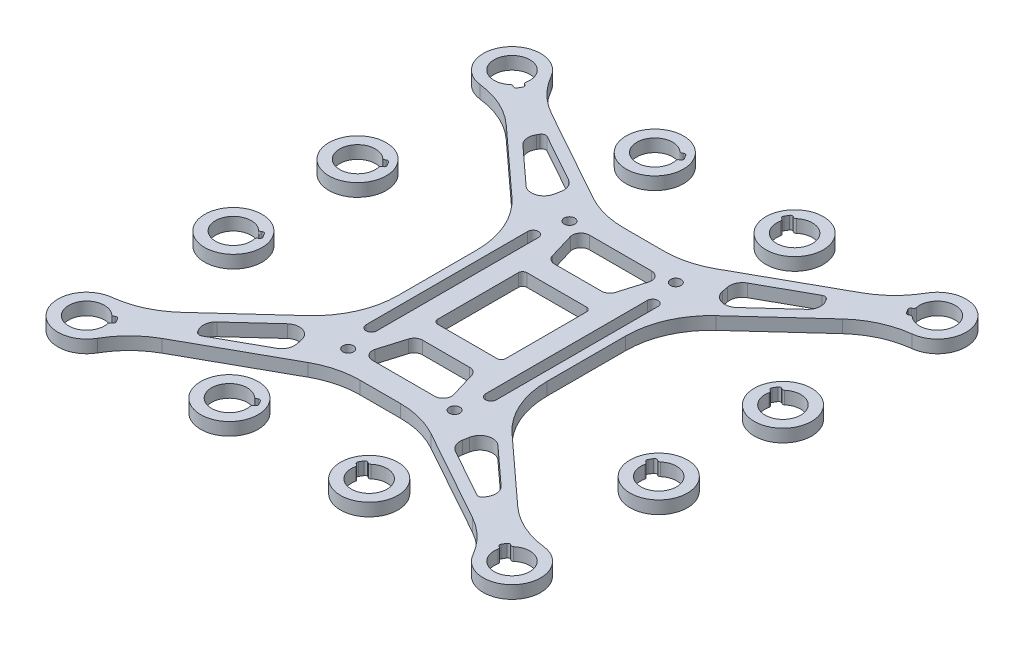
from build123d import *

# Parameters (mm, degrees)
SKETCH1_R             = 6.75
BOSS_EXTRUDE2_DEPTH   = 3
BOSS_EXTRUDE2_2_DEPTH = 3
BOSS_EXTRUDE2_3_DEPTH = 3
BOSS_EXTRUDE2_4_DEPTH = 3
BOSS_EXTRUDE2_5_DEPTH = 3
BOSS_EXTRUDE2_6_DEPTH = 3
BOSS_EXTRUDE2_7_DEPTH = 3
BOSS_EXTRUDE2_8_DEPTH = 3
SKETCH1_R_2           = 1.25
BOSS_EXTRUDE2_9_DEPTH = 3


with BuildPart() as part:
    # Sketch1 → Boss-Extrude2 (new body)
    with BuildSketch(Plane(origin=(0, 0, 0), x_dir=(1, 0, 0), z_dir=(0, 1, 0))):
        with Locations(Location((50, -15.5, 0), (0, 0, 270))):
            Circle(SKETCH1_R)
        with BuildLine():
            Line((46.447201655, -12.264629245), (46.659390087, -12.388677867))
            ThreePointArc((46.659390087, -12.388677867), (46.958645317, -12.454824347), (47.240276851, -12.333941229))
            ThreePointArc((47.240276851, -12.333941229), (53.625846535, -17.619725667), (45.887260468, -14.648311358))
            ThreePointArc((45.887260468, -14.648311358), (45.854440801, -14.34359523), (45.649996913, -14.115271456))
            Line((45.649996913, -14.115271456), (45.43780848, -13.991222834))
            ThreePointArc((45.43780848, -13.991222834), (45.206498076, -13.686358756), (45.258508377, -13.307226143))
            Line((45.258508377, -13.307226143), (45.763204964, -12.443929349))
            ThreePointArc((45.763204964, -12.443929349), (46.068069042, -12.212618944), (46.447201655, -12.264629245))
        make_face(mode=Mode.SUBTRACT)
    extrude(amount=BOSS_EXTRUDE2_DEPTH)


with BuildPart() as body_2:
    # Sketch1 → Boss-Extrude2 2 (new body)
    with BuildSketch(Plane(origin=(0, 0, 0), x_dir=(1, 0, 0), z_dir=(0, 1, 0))):
        with Locations(Location((50, 13.690839766, 0), (0, 0, 270))):
            Circle(SKETCH1_R)
        with BuildLine():
            Line((45.763204964, 16.746910417), (45.258508377, 15.883613623))
            ThreePointArc((45.258508377, 15.883613623), (45.206498076, 15.504481011), (45.43780848, 15.199616932))
            Line((45.43780848, 15.199616932), (45.649996913, 15.07556831))
            ThreePointArc((45.649996913, 15.07556831), (45.854440801, 14.847244536), (45.887260468, 14.542528408))
            ThreePointArc((45.887260468, 14.542528408), (53.625846535, 11.571114099), (47.240276851, 16.856898537))
            ThreePointArc((47.240276851, 16.856898537), (46.958645317, 16.736015419), (46.659390087, 16.802161899))
            Line((46.659390087, 16.802161899), (46.447201655, 16.926210521))
            ThreePointArc((46.447201655, 16.926210521), (46.068069042, 16.978220822), (45.763204964, 16.746910417))
        make_face(mode=Mode.SUBTRACT)
    extrude(amount=BOSS_EXTRUDE2_2_DEPTH)


with BuildPart() as body_3:
    # Sketch1 → Boss-Extrude2 3 (new body)
    with BuildSketch(Plane(origin=(0, 0, 0), x_dir=(1, 0, 0), z_dir=(0, 1, 0))):
        with Locations(Location((-50, -15.5, 0), (0, 0, 90))):
            Circle(SKETCH1_R)
        with BuildLine():
            Line((-45.43780848, -13.991222834), (-45.649996913, -14.115271456))
            ThreePointArc((-45.649996913, -14.115271456), (-45.854440801, -14.34359523), (-45.887260468, -14.648311358))
            ThreePointArc((-45.887260468, -14.648311358), (-53.625846535, -17.619725667), (-47.240276851, -12.333941229))
            ThreePointArc((-47.240276851, -12.333941229), (-46.958645317, -12.454824347), (-46.659390087, -12.388677867))
            Line((-46.659390087, -12.388677867), (-46.447201655, -12.264629245))
            ThreePointArc((-46.447201655, -12.264629245), (-46.068069042, -12.212618944), (-45.763204964, -12.443929349))
            Line((-45.763204964, -12.443929349), (-45.258508377, -13.307226143))
            ThreePointArc((-45.258508377, -13.307226143), (-45.206498076, -13.686358756), (-45.43780848, -13.991222834))
        make_face(mode=Mode.SUBTRACT)
    extrude(amount=BOSS_EXTRUDE2_3_DEPTH)


with BuildPart() as body_4:
    # Sketch1 → Boss-Extrude2 4 (new body)
    with BuildSketch(Plane(origin=(0, 0, 0), x_dir=(1, 0, 0), z_dir=(0, 1, 0))):
        with Locations(Location((-50, 13.690839766, 0), (0, 0, 90))):
            Circle(SKETCH1_R)
        with BuildLine():
            Line((-46.447201655, 16.926210521), (-46.659390087, 16.802161899))
            ThreePointArc((-46.659390087, 16.802161899), (-46.958645317, 16.736015419), (-47.240276851, 16.856898537))
            ThreePointArc((-47.240276851, 16.856898537), (-53.625846535, 11.571114099), (-45.887260468, 14.542528408))
            ThreePointArc((-45.887260468, 14.542528408), (-45.854440801, 14.847244536), (-45.649996913, 15.07556831))
            Line((-45.649996913, 15.07556831), (-45.43780848, 15.199616932))
            ThreePointArc((-45.43780848, 15.199616932), (-45.206498076, 15.504481011), (-45.258508377, 15.883613623))
            Line((-45.258508377, 15.883613623), (-45.763204964, 16.746910417))
            ThreePointArc((-45.763204964, 16.746910417), (-46.068069042, 16.978220822), (-46.447201655, 16.926210521))
        make_face(mode=Mode.SUBTRACT)
    extrude(amount=BOSS_EXTRUDE2_4_DEPTH)


with BuildPart() as body_5:
    # Sketch1 → Boss-Extrude2 5 (new body)
    with BuildSketch(Plane(origin=(0, 0, 0), x_dir=(1, 0, 0), z_dir=(0, 1, 0))):
        with Locations(Location((16.431043837, 50, 0), (0, 0, 270))):
            Circle(SKETCH1_R)
        with BuildLine():
            Line((12.194248802, 53.056070651), (11.689552214, 52.192773857))
            ThreePointArc((11.689552214, 52.192773857), (11.637541913, 51.813641244), (11.868852318, 51.508777166))
            Line((11.868852318, 51.508777166), (12.08104075, 51.384728544))
            ThreePointArc((12.08104075, 51.384728544), (12.285484639, 51.15640477), (12.318304306, 50.851688642))
            ThreePointArc((12.318304306, 50.851688642), (20.056890373, 47.880274333), (13.671320689, 53.166058771))
            ThreePointArc((13.671320689, 53.166058771), (13.389689154, 53.045175653), (13.090433925, 53.111322133))
            Line((13.090433925, 53.111322133), (12.878245492, 53.235370755))
            ThreePointArc((12.878245492, 53.235370755), (12.49911288, 53.287381056), (12.194248802, 53.056070651))
        make_face(mode=Mode.SUBTRACT)
    extrude(amount=BOSS_EXTRUDE2_5_DEPTH)


with BuildPart() as body_6:
    # Sketch1 → Boss-Extrude2 6 (new body)
    with BuildSketch(Plane(origin=(0, 0, 0), x_dir=(1, 0, 0), z_dir=(0, 1, 0))):
        with Locations(Location((16.431043837, -50, 0), (0, 0, 270))):
            Circle(SKETCH1_R)
        with BuildLine():
            Line((12.194248802, -46.943929349), (11.689552214, -47.807226143))
            ThreePointArc((11.689552214, -47.807226143), (11.637541913, -48.186358756), (11.868852318, -48.491222834))
            Line((11.868852318, -48.491222834), (12.08104075, -48.615271456))
            ThreePointArc((12.08104075, -48.615271456), (12.285484639, -48.84359523), (12.318304306, -49.148311358))
            ThreePointArc((12.318304306, -49.148311358), (20.056890373, -52.119725667), (13.671320689, -46.833941229))
            ThreePointArc((13.671320689, -46.833941229), (13.389689154, -46.954824347), (13.090433925, -46.888677867))
            Line((13.090433925, -46.888677867), (12.878245492, -46.764629245))
            ThreePointArc((12.878245492, -46.764629245), (12.49911288, -46.712618944), (12.194248802, -46.943929349))
        make_face(mode=Mode.SUBTRACT)
    extrude(amount=BOSS_EXTRUDE2_6_DEPTH)


with BuildPart() as body_7:
    # Sketch1 → Boss-Extrude2 7 (new body)
    with BuildSketch(Plane(origin=(0, 0, 0), x_dir=(1, 0, 0), z_dir=(0, 1, 0))):
        with Locations(Location((-16.431043837, -50, 0), (0, 0, 90))):
            Circle(SKETCH1_R)
        with BuildLine():
            Line((-12.878245492, -46.764629245), (-13.090433925, -46.888677867))
            ThreePointArc((-13.090433925, -46.888677867), (-13.389689154, -46.954824347), (-13.671320689, -46.833941229))
            ThreePointArc((-13.671320689, -46.833941229), (-20.056890373, -52.119725667), (-12.318304306, -49.148311358))
            ThreePointArc((-12.318304306, -49.148311358), (-12.285484639, -48.84359523), (-12.08104075, -48.615271456))
            Line((-12.08104075, -48.615271456), (-11.868852318, -48.491222834))
            ThreePointArc((-11.868852318, -48.491222834), (-11.637541913, -48.186358756), (-11.689552214, -47.807226143))
            Line((-11.689552214, -47.807226143), (-12.194248802, -46.943929349))
            ThreePointArc((-12.194248802, -46.943929349), (-12.49911288, -46.712618944), (-12.878245492, -46.764629245))
        make_face(mode=Mode.SUBTRACT)
    extrude(amount=BOSS_EXTRUDE2_7_DEPTH)


with BuildPart() as body_8:
    # Sketch1 → Boss-Extrude2 8 (new body)
    with BuildSketch(Plane(origin=(0, 0, 0), x_dir=(1, 0, 0), z_dir=(0, 1, 0))):
        with Locations(Location((-16.431043837, 50, 0), (0, 0, 90))):
            Circle(SKETCH1_R)
        with BuildLine():
            Line((-11.868852318, 51.508777166), (-12.08104075, 51.384728544))
            ThreePointArc((-12.08104075, 51.384728544), (-12.285484639, 51.15640477), (-12.318304306, 50.851688642))
            ThreePointArc((-12.318304306, 50.851688642), (-20.056890373, 47.880274333), (-13.671320689, 53.166058771))
            ThreePointArc((-13.671320689, 53.166058771), (-13.389689154, 53.045175653), (-13.090433925, 53.111322133))
            Line((-13.090433925, 53.111322133), (-12.878245492, 53.235370755))
            ThreePointArc((-12.878245492, 53.235370755), (-12.49911288, 53.287381056), (-12.194248802, 53.056070651))
            Line((-12.194248802, 53.056070651), (-11.689552214, 52.192773857))
            ThreePointArc((-11.689552214, 52.192773857), (-11.637541913, 51.813641244), (-11.868852318, 51.508777166))
        make_face(mode=Mode.SUBTRACT)
    extrude(amount=BOSS_EXTRUDE2_8_DEPTH)


with BuildPart() as body_9:
    # Sketch1 → Boss-Extrude2 9 (new body)
    with BuildSketch(Plane(origin=(0, 0, 0), x_dir=(1, 0, 0), z_dir=(0, 1, 0))):
        with BuildLine():
            Line((24.00967947, -23.998157212), (39.539836323, -38.187381585))
            ThreePointArc((39.539836323, -38.187381585), (44.748868105, -41.627128922), (50.764619019, -43.293446656))
            ThreePointArc((50.764619019, -43.293446656), (55.634209854, -53.717281173), (44.135162408, -53.341583459))
            ThreePointArc((44.135162408, -53.341583459), (40.826408198, -49.027223589), (36.477933999, -45.763433208))
            Line((36.477933999, -45.763433208), (14.462697449, -33.520861723))
            ThreePointArc((14.462697449, -33.520861723), (9.763447669, -31.640470492), (4.742629287, -31))
            Line((4.742629287, -31), (-4.742629287, -31))
            ThreePointArc((-4.742629287, -31), (-9.763447669, -31.640470492), (-14.462697449, -33.520861723))
            Line((-14.462697449, -33.520861723), (-36.477933999, -45.763433208))
            ThreePointArc((-36.477933999, -45.763433208), (-40.826408198, -49.027223589), (-44.135162408, -53.341583459))
            ThreePointArc((-44.135162408, -53.341583459), (-55.634209854, -53.717281173), (-50.764619019, -43.293446656))
            ThreePointArc((-50.764619019, -43.293446656), (-44.748868105, -41.627128922), (-39.539836323, -38.187381585))
            Line((-39.539836323, -38.187381585), (-24.00967947, -23.998157212))
            ThreePointArc((-24.00967947, -23.998157212), (-19.199639203, -17.301211584), (-17.5, -9.232953116))
            Line((-17.5, -9.232953116), (-17.5, 9.232953116))
            ThreePointArc((-17.5, 9.232953116), (-19.199639203, 17.301211584), (-24.00967947, 23.998157212))
            Line((-24.00967947, 23.998157212), (-39.539836323, 38.187381585))
            ThreePointArc((-39.539836323, 38.187381585), (-44.748868105, 41.627128922), (-50.764619019, 43.293446656))
            ThreePointArc((-50.764619019, 43.293446656), (-55.634209854, 53.717281173), (-44.135162408, 53.341583459))
            ThreePointArc((-44.135162408, 53.341583459), (-40.826408198, 49.027223589), (-36.477933999, 45.763433208))
            Line((-36.477933999, 45.763433208), (-14.462697449, 33.520861723))
            ThreePointArc((-14.462697449, 33.520861723), (-9.763447669, 31.640470492), (-4.742629287, 31))
            Line((-4.742629287, 31), (4.742629287, 31))
            ThreePointArc((4.742629287, 31), (9.763447669, 31.640470492), (14.462697449, 33.520861723))
            Line((14.462697449, 33.520861723), (36.477933999, 45.763433208))
            ThreePointArc((36.477933999, 45.763433208), (40.826408198, 49.027223589), (44.135162408, 53.341583459))
            ThreePointArc((44.135162408, 53.341583459), (55.634209854, 53.717281173), (50.764619019, 43.293446656))
            ThreePointArc((50.764619019, 43.293446656), (44.748868105, 41.627128922), (39.539836323, 38.187381585))
            Line((39.539836323, 38.187381585), (24.00967947, 23.998157212))
            ThreePointArc((24.00967947, 23.998157212), (19.199639203, 17.301211584), (17.5, 9.232953116))
            Line((17.5, 9.232953116), (17.5, -9.232953116))
            ThreePointArc((17.5, -9.232953116), (19.199639203, -17.301211584), (24.00967947, -23.998157212))
        make_face()
        with Locations(Location((-12.5, 26, 0), (0, 0, 270))):
            Circle(SKETCH1_R_2, mode=Mode.SUBTRACT)
        with Locations(Location((12.5, 26, 0), (0, 0, 90))):
            Circle(SKETCH1_R_2, mode=Mode.SUBTRACT)
        with Locations(Location((12.5, -26, 0), (0, 0, 270))):
            Circle(SKETCH1_R_2, mode=Mode.SUBTRACT)
        with Locations(Location((-12.5, -26, 0), (0, 0, 90))):
            Circle(SKETCH1_R_2, mode=Mode.SUBTRACT)
        with BuildLine():
            Line((-12.8, 19), (-12.8, -19))
            ThreePointArc((-12.8, -19), (-14.05, -20.25), (-15.3, -19))
            Line((-15.3, -19), (-15.3, 19))
            ThreePointArc((-15.3, 19), (-14.05, 20.25), (-12.8, 19))
        make_face(mode=Mode.SUBTRACT)
        with BuildLine():
            Line((-7, -10.5), (7, -10.5))
            ThreePointArc((7, -10.5), (7.707106781, -10.207106781), (8, -9.5))
            Line((8, -9.5), (8, 9.5))
            ThreePointArc((8, 9.5), (7.707106781, 10.207106781), (7, 10.5))
            Line((7, 10.5), (-7, 10.5))
            ThreePointArc((-7, 10.5), (-7.707106781, 10.207106781), (-8, 9.5))
            Line((-8, 9.5), (-8, -9.5))
            ThreePointArc((-8, -9.5), (-7.707106781, -10.207106781), (-7, -10.5))
        make_face(mode=Mode.SUBTRACT)
        with BuildLine():
            Line((12.8, 19), (12.8, -19))
            ThreePointArc((12.8, -19), (14.05, -20.25), (15.3, -19))
            Line((15.3, -19), (15.3, 19))
            ThreePointArc((15.3, 19), (14.05, 20.25), (12.8, 19))
        make_face(mode=Mode.SUBTRACT)
        with BuildLine():
            Line((21.01694027, -34.305093002), (32.308432633, -40.584239815))
            ThreePointArc((32.308432633, -40.584239815), (33.058397917, -40.674816015), (33.657732835, -40.214979489))
            Line((33.657732835, -40.214979489), (33.964133092, -39.690873785))
            ThreePointArc((33.964133092, -39.690873785), (34.34022858, -37.72630892), (33.397790789, -35.962003409))
            Line((33.397790789, -35.962003409), (24.753925164, -28.064481834))
            ThreePointArc((24.753925164, -28.064481834), (21.771707669, -27.436560749), (19.778827006, -29.742278152))
            Line((19.778827006, -29.742278152), (19.523400416, -31.146237963))
            ThreePointArc((19.523400416, -31.146237963), (19.762820924, -32.965545619), (21.01694027, -34.305093002))
        make_face(mode=Mode.SUBTRACT)
        with BuildLine():
            Line((19.778827006, 29.742278152), (19.523400416, 31.146237963))
            ThreePointArc((19.523400416, 31.146237963), (19.762820924, 32.965545619), (21.01694027, 34.305093002))
            Line((21.01694027, 34.305093002), (32.308432633, 40.584239815))
            ThreePointArc((32.308432633, 40.584239815), (33.058397917, 40.674816015), (33.657732835, 40.214979489))
            Line((33.657732835, 40.214979489), (33.964133092, 39.690873785))
            ThreePointArc((33.964133092, 39.690873785), (34.34022858, 37.72630892), (33.397790789, 35.962003409))
            Line((33.397790789, 35.962003409), (24.753925164, 28.064481834))
            ThreePointArc((24.753925164, 28.064481834), (21.771707669, 27.436560749), (19.778827006, 29.742278152))
        make_face(mode=Mode.SUBTRACT)
        with BuildLine():
            Line((-33.657732835, -40.214979489), (-33.964133092, -39.690873785))
            ThreePointArc((-33.964133092, -39.690873785), (-34.34022858, -37.72630892), (-33.397790789, -35.962003409))
            Line((-33.397790789, -35.962003409), (-24.753925164, -28.064481834))
            ThreePointArc((-24.753925164, -28.064481834), (-21.771707669, -27.436560749), (-19.778827006, -29.742278152))
            Line((-19.778827006, -29.742278152), (-19.523400416, -31.146237963))
            ThreePointArc((-19.523400416, -31.146237963), (-19.762820924, -32.965545619), (-21.01694027, -34.305093002))
            Line((-21.01694027, -34.305093002), (-32.308432633, -40.584239815))
            ThreePointArc((-32.308432633, -40.584239815), (-33.058397917, -40.674816015), (-33.657732835, -40.214979489))
        make_face(mode=Mode.SUBTRACT)
        with BuildLine():
            Line((-19.778827006, 29.742278152), (-19.523400416, 31.146237963))
            ThreePointArc((-19.523400416, 31.146237963), (-19.762820924, 32.965545619), (-21.01694027, 34.305093002))
            Line((-21.01694027, 34.305093002), (-32.308432633, 40.584239815))
            ThreePointArc((-32.308432633, 40.584239815), (-33.058397917, 40.674816015), (-33.657732835, 40.214979489))
            Line((-33.657732835, 40.214979489), (-33.964133092, 39.690873785))
            ThreePointArc((-33.964133092, 39.690873785), (-34.34022858, 37.72630892), (-33.397790789, 35.962003409))
            Line((-33.397790789, 35.962003409), (-24.753925164, 28.064481834))
            ThreePointArc((-24.753925164, 28.064481834), (-21.771707669, 27.436560749), (-19.778827006, 29.742278152))
        make_face(mode=Mode.SUBTRACT)
        with BuildLine():
            Line((-5.511938698, 15.5), (5.511938698, 15.5))
            ThreePointArc((5.511938698, 15.5), (6.705799757, 15.895414143), (7.427591269, 16.925304229))
            Line((7.427591269, 16.925304229), (9.227591269, 22.925304229))
            ThreePointArc((9.227591269, 22.925304229), (8.916524555, 24.693861059), (7.311938698, 25.5))
            Line((7.311938698, 25.5), (-7.311938698, 25.5))
            ThreePointArc((-7.311938698, 25.5), (-8.916524555, 24.693861059), (-9.227591269, 22.925304229))
            Line((-9.227591269, 22.925304229), (-7.427591269, 16.925304229))
            ThreePointArc((-7.427591269, 16.925304229), (-6.705799757, 15.895414143), (-5.511938698, 15.5))
        make_face(mode=Mode.SUBTRACT)
        with BuildLine():
            Line((-7.427591269, -16.925304229), (-9.227591269, -22.925304229))
            ThreePointArc((-9.227591269, -22.925304229), (-8.916524555, -24.693861059), (-7.311938698, -25.5))
            Line((-7.311938698, -25.5), (7.311938698, -25.5))
            ThreePointArc((7.311938698, -25.5), (8.916524555, -24.693861059), (9.227591269, -22.925304229))
            Line((9.227591269, -22.925304229), (7.427591269, -16.925304229))
            ThreePointArc((7.427591269, -16.925304229), (6.705799757, -15.895414143), (5.511938698, -15.5))
            Line((5.511938698, -15.5), (-5.511938698, -15.5))
            ThreePointArc((-5.511938698, -15.5), (-6.705799757, -15.895414143), (-7.427591269, -16.925304229))
        make_face(mode=Mode.SUBTRACT)
        with BuildLine():
            Line((45.763204964, -46.943929349), (45.258508377, -47.807226143))
            ThreePointArc((45.258508377, -47.807226143), (45.206498076, -48.186358756), (45.43780848, -48.491222834))
            Line((45.43780848, -48.491222834), (45.649996913, -48.615271456))
            ThreePointArc((45.649996913, -48.615271456), (45.854440801, -48.84359523), (45.887260468, -49.148311358))
            ThreePointArc((45.887260468, -49.148311358), (53.625846535, -52.119725667), (47.240276851, -46.833941229))
            ThreePointArc((47.240276851, -46.833941229), (46.958645317, -46.954824347), (46.659390087, -46.888677867))
            Line((46.659390087, -46.888677867), (46.447201655, -46.764629245))
            ThreePointArc((46.447201655, -46.764629245), (46.068069042, -46.712618944), (45.763204964, -46.943929349))
        make_face(mode=Mode.SUBTRACT)
        with BuildLine():
            Line((-45.763204964, -46.943929349), (-45.258508377, -47.807226143))
            ThreePointArc((-45.258508377, -47.807226143), (-45.206498076, -48.186358756), (-45.43780848, -48.491222834))
            Line((-45.43780848, -48.491222834), (-45.649996913, -48.615271456))
            ThreePointArc((-45.649996913, -48.615271456), (-45.854440801, -48.84359523), (-45.887260468, -49.148311358))
            ThreePointArc((-45.887260468, -49.148311358), (-53.625846535, -52.119725667), (-47.240276851, -46.833941229))
            ThreePointArc((-47.240276851, -46.833941229), (-46.958645317, -46.954824347), (-46.659390087, -46.888677867))
            Line((-46.659390087, -46.888677867), (-46.447201655, -46.764629245))
            ThreePointArc((-46.447201655, -46.764629245), (-46.068069042, -46.712618944), (-45.763204964, -46.943929349))
        make_face(mode=Mode.SUBTRACT)
        with BuildLine():
            Line((45.763204964, 46.943929349), (45.258508377, 47.807226143))
            ThreePointArc((45.258508377, 47.807226143), (45.206498076, 48.186358756), (45.43780848, 48.491222834))
            Line((45.43780848, 48.491222834), (45.649996913, 48.615271456))
            ThreePointArc((45.649996913, 48.615271456), (45.854440801, 48.84359523), (45.887260468, 49.148311358))
            ThreePointArc((45.887260468, 49.148311358), (53.625846535, 52.119725667), (47.240276851, 46.833941229))
            ThreePointArc((47.240276851, 46.833941229), (46.958645317, 46.954824347), (46.659390087, 46.888677867))
            Line((46.659390087, 46.888677867), (46.447201655, 46.764629245))
            ThreePointArc((46.447201655, 46.764629245), (46.068069042, 46.712618944), (45.763204964, 46.943929349))
        make_face(mode=Mode.SUBTRACT)
        with BuildLine():
            Line((-45.763204964, 46.943929349), (-45.258508377, 47.807226143))
            ThreePointArc((-45.258508377, 47.807226143), (-45.206498076, 48.186358756), (-45.43780848, 48.491222834))
            Line((-45.43780848, 48.491222834), (-45.649996913, 48.615271456))
            ThreePointArc((-45.649996913, 48.615271456), (-45.854440801, 48.84359523), (-45.887260468, 49.148311358))
            ThreePointArc((-45.887260468, 49.148311358), (-53.625846535, 52.119725667), (-47.240276851, 46.833941229))
            ThreePointArc((-47.240276851, 46.833941229), (-46.958645317, 46.954824347), (-46.659390087, 46.888677867))
            Line((-46.659390087, 46.888677867), (-46.447201655, 46.764629245))
            ThreePointArc((-46.447201655, 46.764629245), (-46.068069042, 46.712618944), (-45.763204964, 46.943929349))
        make_face(mode=Mode.SUBTRACT)
    extrude(amount=BOSS_EXTRUDE2_9_DEPTH)


solid = Compound([part.part, body_2.part, body_3.part, body_4.part, body_5.part, body_6.part, body_7.part, body_8.part, body_9.part])
